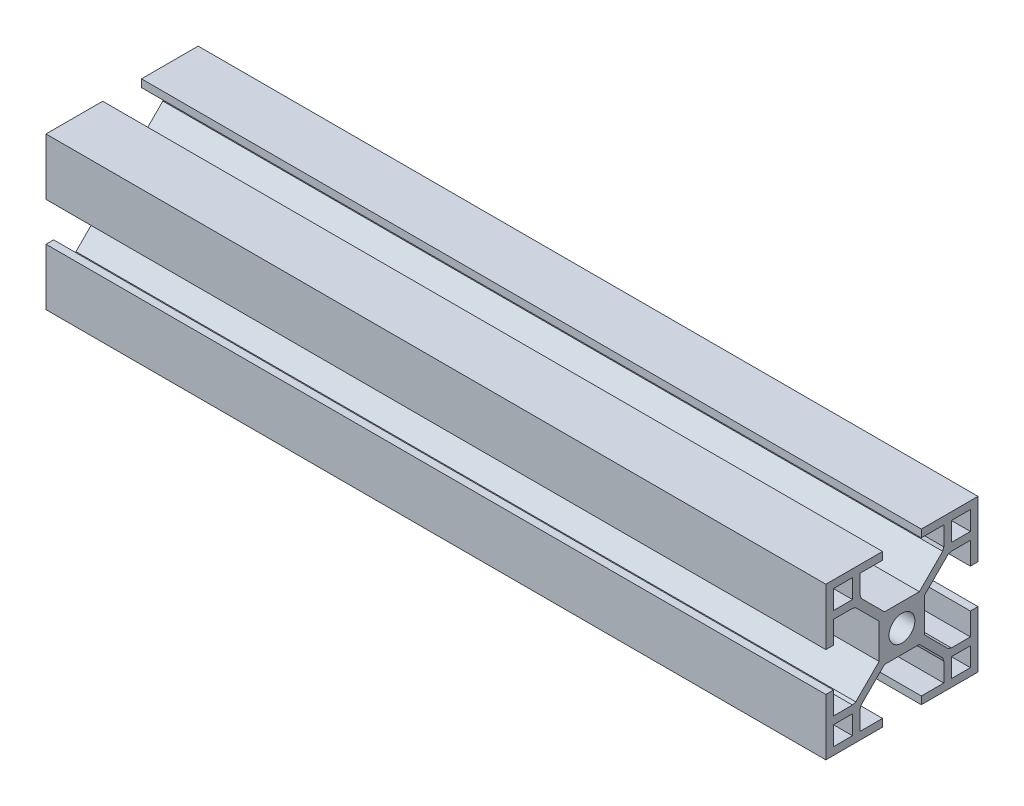
from build123d import *

# Parameters (mm, degrees)
SKETCH_1_R      = 3.4
SKETCH_1_W      = 5
SKETCH_1_H      = 5
EXTRUDE_1_DEPTH = 205


with BuildPart() as part:
    # 草图1 → 凸台-拉伸1 (new body)
    with BuildSketch(Plane(origin=(0, 0, 0), x_dir=(0, 0, -1), z_dir=(1, 0, 0))):
        Polygon((0, 6), (4.585786438, 6), (10.718811909, 12.133025471), (11, 13), (11, 18), (5.1, 18), (5.1, 20), (20, 20), (20, 5.1), (18, 5.1), (18, 11), (13, 11), (12.133025471, 10.718811909), (6, 4.585786438), (6, 0), (6, -4.585786438), (12.133025471, -10.718811909), (13, -11), (18, -11), (18, -5.1), (20, -5.1), (20, -20), (5.1, -20), (5.1, -18), (11, -18), (11, -13), (10.718811909, -12.133025471), (4.585786438, -6), (0, -6), (-4.585786438, -6), (-10.718811909, -12.133025471), (-11, -13), (-11, -18), (-5.1, -18), (-5.1, -20), (-20, -20), (-20, -5.1), (-18, -5.1), (-18, -11), (-13, -11), (-12.133025471, -10.718811909), (-6, -4.585786438), (-6, 0), (-6, 4.585786438), (-12.133025471, 10.718811909), (-13, 11), (-18, 11), (-18, 5.1), (-20, 5.1), (-20, 20), (-5.1, 20), (-5.1, 18), (-11, 18), (-11, 13), (-10.718811909, 12.133025471), (-4.585786438, 6), align=None)
        with Locations(Location((0, 0, 0), (0, 0, 180))):
            Circle(SKETCH_1_R, mode=Mode.SUBTRACT)
        with Locations((15.5, -15.5)):
            Rectangle(SKETCH_1_W, SKETCH_1_H, mode=Mode.SUBTRACT)
        with Locations((15.5, 15.5)):
            Rectangle(SKETCH_1_W, SKETCH_1_H, mode=Mode.SUBTRACT)
        with Locations((-15.5, -15.5)):
            Rectangle(SKETCH_1_W, SKETCH_1_H, mode=Mode.SUBTRACT)
        with Locations((-15.5, 15.5)):
            Rectangle(SKETCH_1_W, SKETCH_1_H, mode=Mode.SUBTRACT)
    extrude(amount=EXTRUDE_1_DEPTH)


solid = part.part
